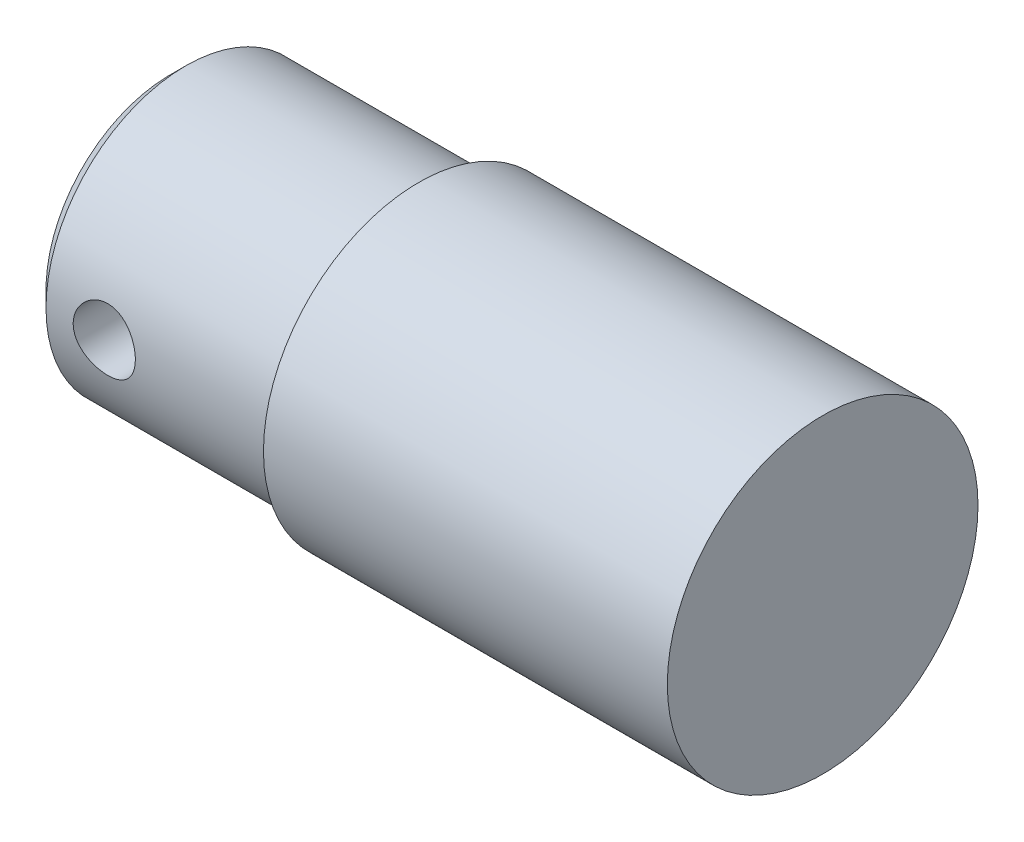
from build123d import *

# Parameters (mm, degrees)
SCHIZZO1_R             = 20
ESTRUSIONE1_DEPTH      = 52
SCHIZZO2_R             = 18
ESTRUSIONE2_DEPTH      = 32
ESTRUSIONE5_DEPTH      = 60.194594348
ESTRUSIONE5_DEPTH_BACK = 60.194594348
SCHIZZO5_R             = 4
SMUSSO2_SIZE           = 2
SCHIZZO3_R             = 17
ESTRUSIONE3_DEPTH      = 2
SCHIZZO4_R             = 18
ESTRUSIONE4_DEPTH      = 4
SMUSSO1_SIZE           = 2
SCHIZZO6_R             = 24.071831276
ESTRUSIONE6_DEPTH      = 10


with BuildPart() as part:
    # Schizzo1 → Estrusione1 (new body)
    with BuildSketch(Plane(origin=(0, 0, 0), x_dir=(0, 0, -1), z_dir=(1, 0, 0))):
        with Locations(Location((0, 0, 0), (0, 0, 180))):
            Circle(SCHIZZO1_R)
    extrude(amount=ESTRUSIONE1_DEPTH)

    # Schizzo2 → Estrusione2 (add)
    with BuildSketch(Plane.ZY):
        with Locations(Location((0, 0, 0), (0, 0, 180))):
            Circle(SCHIZZO2_R)
    extrude(amount=ESTRUSIONE2_DEPTH)

    # Schizzo5 → Estrusione5 (cut, two sides: drawn at the far end of the back side and taken through both)
    with BuildSketch(Plane.XY.offset(-ESTRUSIONE5_DEPTH_BACK)):
        with Locations((-22.5, 0)):
            Circle(SCHIZZO5_R)
    extrude(amount=ESTRUSIONE5_DEPTH + ESTRUSIONE5_DEPTH_BACK, mode=Mode.SUBTRACT)

    # Smusso2
    smusso2_edges = [part.edges().sort_by_distance(p)[0] for p in [
        (-32, 0, 18),
    ]]
    chamfer(smusso2_edges, length=SMUSSO2_SIZE)

    # Schizzo3 → Estrusione3 (add)
    with BuildSketch(Plane.ZY.offset(32)):
        Circle(SCHIZZO3_R)
    extrude(amount=ESTRUSIONE3_DEPTH)

    # Schizzo4 → Estrusione4 (add)
    with BuildSketch(Plane.ZY.offset(34)):
        with Locations(Location((0, 0, 0), (0, 0, 180))):
            Circle(SCHIZZO4_R)
    extrude(amount=ESTRUSIONE4_DEPTH)

    # Smusso1
    smusso1_edges = [part.edges().sort_by_distance(p)[0] for p in [
        (-38, 0, 18),
    ]]
    chamfer(smusso1_edges, length=SMUSSO1_SIZE)

    # Schizzo6 → Estrusione6 (cut)
    with BuildSketch(Plane(origin=(-32, 0, 0), x_dir=(0, 0, -1), z_dir=(1, 0, 0))):
        Circle(SCHIZZO6_R)
    extrude(amount=-ESTRUSIONE6_DEPTH, mode=Mode.SUBTRACT)


solid = part.part
